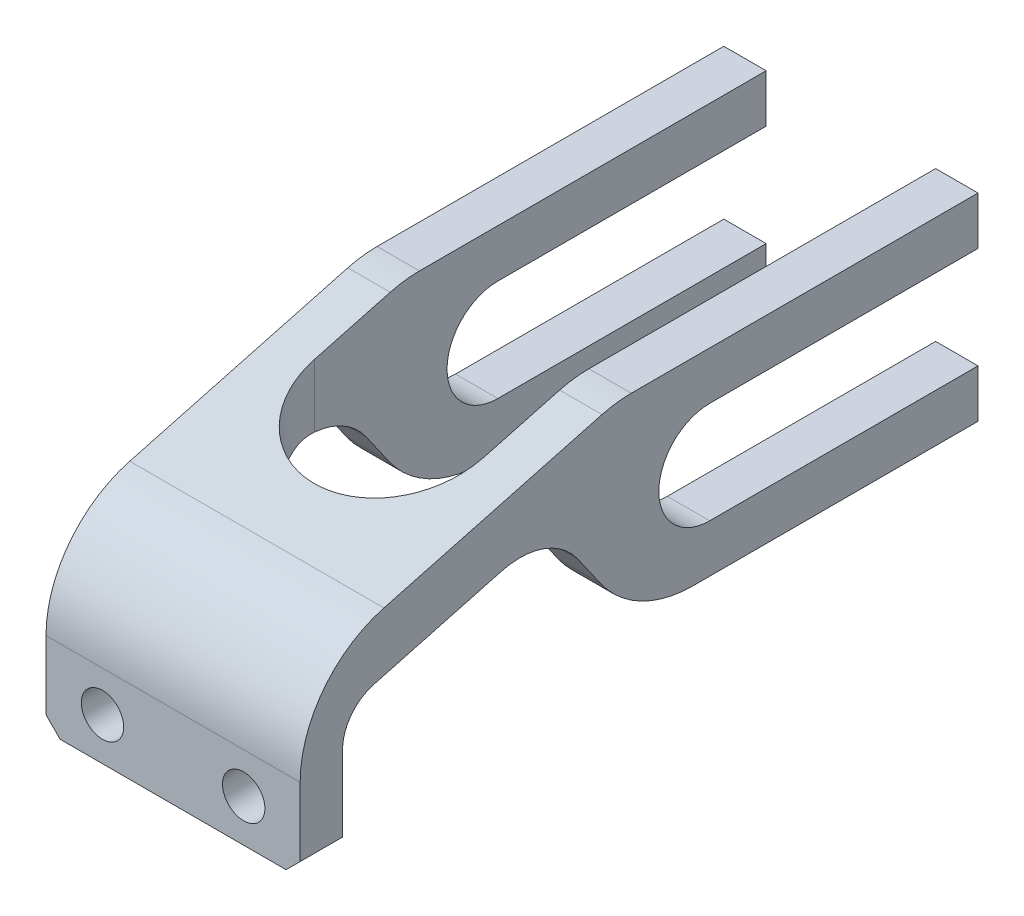
from build123d import *

# Parameters (mm, degrees)
SKETCH_1_W          = 18
SKETCH_1_H          = 12
EXTRUDE_1_DEPTH     = 3
EXTRUDE_2_DEPTH     = 9
EXTRUDE1_DEPTH      = 18
SKETCH_5_R          = 1.5
CUT_EXTRUDE_5_DEPTH = 3
CHAMFER_1_SIZE      = 1
FILLET1_R           = 8
EXTRUDE6_REACH      = 51.295
EXTRUDE7_START      = -18
EXTRUDE7_DEPTH      = 18
FILLET5_R           = 3
FILLET6_R           = 5
FILLET7_R           = 8


with BuildPart() as part:
    # 草图1 → 拉伸1 (new body)
    with BuildSketch(Plane.XY):
        Rectangle(SKETCH_1_W, SKETCH_1_H)
    extrude(amount=EXTRUDE_1_DEPTH)

    # 草图2 → 拉伸2 (add, symmetric)
    with BuildSketch(Plane(origin=(0, 0, 0), x_dir=(0, 0, -1), z_dir=(1, 0, 0))):
        Polygon((19.392304845, 12), (45, 12), (45, 8.2), (20.665324997, 8.2), (0, 2.662742856), (-3, 6), align=None)
    extrude(amount=EXTRUDE_2_DEPTH, both=True)

    # Sketch2 → Extrude1 (add)
    with BuildSketch(Plane(origin=(9, 0, 0), x_dir=(0, 0, -1), z_dir=(1, 0, 0))):
        Polygon((45, 8.2), (20.665324997, 8.2), (14.65151871, 6.588605462), (20.665324997, -2), (45, -2), align=None)
    extrude(amount=-EXTRUDE1_DEPTH)

    # 草图5 → 拉伸5 (cut)
    with BuildSketch(Plane(origin=(0, 0, 0), x_dir=(-1, 0, 0), z_dir=(0, 0, -1))):
        with Locations((-5, -3)):
            Circle(SKETCH_5_R)
        with Locations((5, -3)):
            Circle(SKETCH_5_R)
    extrude(amount=-CUT_EXTRUDE_5_DEPTH, mode=Mode.SUBTRACT)

    # 倒角1
    chamfer_1_edges = [part.edges().sort_by_distance(p)[0] for p in [
        (9, -6, 1.5),
        (-9, -6, 1.5),
    ]]
    chamfer(chamfer_1_edges, length=CHAMFER_1_SIZE)

    # Fillet1
    fillet1_edges = [part.edges().sort_by_distance(p)[0] for p in [
        (0, 6, 3),
        (0, 12, -19.392304845),
    ]]
    fillet(fillet1_edges, radius=FILLET1_R)

    # Extrude6: up to this face of the body (flat: up to its plane)
    extrude6_end = Plane(part.part.faces().sort_by_distance((0, 12, -32.722762413))[0])
    # Sketch3 → Extrude6 (cut, up to the picked face)
    with BuildSketch(Plane.XZ.offset(6), mode=Mode.PRIVATE) as extrude6_sk1:
        with BuildLine():
            Line((-6, -45), (6, -45))
            Line((6, -45), (6, -13))
            ThreePointArc((6, -13), (0, -7), (-6, -13))
            Line((-6, -13), (-6, -45))
        make_face()
    extrude6_tool1 = split(extrude(extrude6_sk1.sketch, amount=-EXTRUDE6_REACH, mode=Mode.PRIVATE), bisect_by=extrude6_end, keep=Keep.BOTH, mode=Mode.PRIVATE)
    add(extrude6_tool1.solids().sort_by(Axis((0, -6, -26.619381), (0, 1, 0)))[0], mode=Mode.SUBTRACT)

    # Sketch4 → Extrude7 (cut)
    with BuildSketch(Plane(origin=(9, 0, 0), x_dir=(0, 0, -1), z_dir=(1, 0, 0)).offset(EXTRUDE7_START)):
        with BuildLine():
            Line((26, 8.6), (45, 8.6))
            Line((45, 8.6), (45, 1.4))
            Line((45, 1.4), (26, 1.4))
            ThreePointArc((26, 1.4), (22.4, 5), (26, 8.6))
        make_face()
    extrude(amount=EXTRUDE7_DEPTH, mode=Mode.SUBTRACT)

    # Fillet5
    fillet5_edges = [part.edges().sort_by_distance(p)[0] for p in [
        (0, 2.662742856, 0),
    ]]
    fillet(fillet5_edges, radius=FILLET5_R)

    # Fillet6
    fillet6_edges = [part.edges().sort_by_distance(p)[0] for p in [
        (-7.5, 6.588605462, -14.65151871),
        (7.5, 6.588605462, -14.65151871),
    ]]
    fillet(fillet6_edges, radius=FILLET6_R)

    # Fillet7
    fillet7_edges = [part.edges().sort_by_distance(p)[0] for p in [
        (-7.5, -2, -20.665324997),
        (7.5, -2, -20.665324997),
    ]]
    fillet(fillet7_edges, radius=FILLET7_R)


solid = part.part
